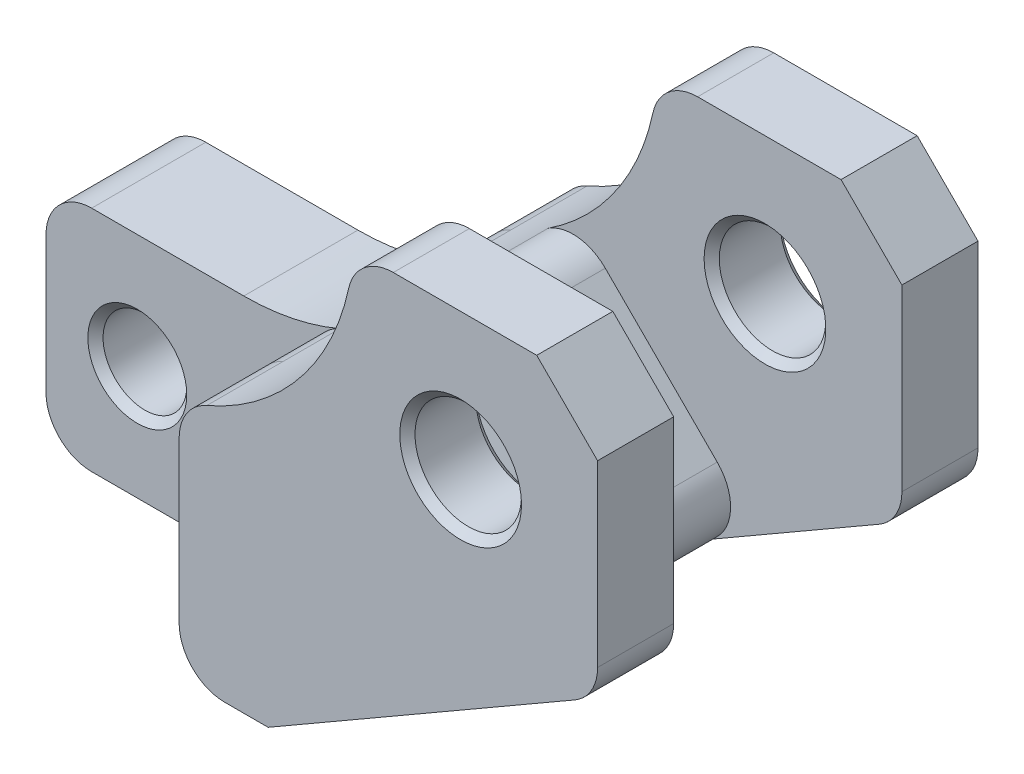
from build123d import *

# Parameters (mm, degrees)
BOSS_EXTRUDE1_DEPTH       = 10
FILLET1_R                 = 6
FILLET2_R                 = 6
FILLET3_R                 = 6
CUT_EXTRUDE1_REACH        = 92.604
SKETCH4_R                 = 7.000000000000001
CHAMFER1_SIZE             = 1
CHAMFER2_SIZE             = 1
BOSS_EXTRUDE2_DEPTH       = 7.5
FILLET4_R                 = 6
SKETCH5_R                 = 5.5
CUT_EXTRUDE2_DEPTH        = 15
CHAMFER3_SIZE             = 1
BOSS_EXTRUDE3_DEPTH       = 15
FILLET5_R                 = 6
FILLET1_OF_MIRROR16_R     = 6
FILLET2_OF_MIRROR16_R     = 6
FILLET3_OF_MIRROR16_R     = 6
CHAMFER1_OF_MIRROR16_SIZE = 1
CHAMFER2_OF_MIRROR16_SIZE = 1


with BuildPart() as part:
    # Sketch3 → Boss-Extrude1 (new body)
    with BuildSketch(Plane.XY.offset(15)):
        with BuildLine():
            Line((45.93743884534262, 45.00000000000001), (69.99999999999996, 45))
            Line((69.99999999999996, 45), (77.99999999999999, 37))
            Line((77.99999999999999, 37), (77.99999999999999, 9.999999999999998))
            Line((77.99999999999999, 9.999999999999998), (34.69872981077818, -15.000000000000004))
            Line((34.69872981077818, -15.000000000000004), (22.999999999999996, -15.000000000000005))
            Line((22.999999999999996, -15.000000000000005), (22.99999999999999, 16.291694934431824))
            ThreePointArc((22.99999999999999, 16.291694934431824), (39.00020339394204, 27.025270208047246), (45.93743884534262, 45.00000000000001))
        make_face()
    boss_extrude1 = extrude(amount=BOSS_EXTRUDE1_DEPTH)

    # Fillet1
    fillet1_edges = [part.edges().sort_by_distance(p)[0] for p in [
        (45.93743884534262, 45.00000000000001, 20),
    ]]
    fillet(fillet1_edges, radius=FILLET1_R)

    # Fillet2
    fillet2_edges = [part.edges().sort_by_distance(p)[0] for p in [
        (22.999999999999996, -15.000000000000005, 20),
    ]]
    fillet(fillet2_edges, radius=FILLET2_R)

    # Fillet3
    fillet3_edges = [part.edges().sort_by_distance(p)[0] for p in [
        (77.99999999999999, 9.999999999999998, 20),
        (22.999999999999993, 16.29169493443182, 20),
    ]]
    fillet(fillet3_edges, radius=FILLET3_R)

    # Sketch4 → Cut-Extrude1 (cut, up to next)
    with BuildSketch(Plane.XY.offset(25), mode=Mode.PRIVATE) as cut_extrude1_sk1:
        with Locations((59.999999999999986, 27)):
            Circle(SKETCH4_R)
    cut_extrude1_tool1 = extrude(cut_extrude1_sk1.sketch, amount=-CUT_EXTRUDE1_REACH, mode=Mode.PRIVATE) & part.part
    cut_extrude1 = cut_extrude1_tool1.solids().sort_by_distance((60, 27, 25))[0]
    add(cut_extrude1, mode=Mode.SUBTRACT)

    # Chamfer1
    chamfer1_edges = [part.edges().sort_by_distance(p)[0] for p in [
        (52.999999999999986, 27, 25),
    ]]
    chamfer(chamfer1_edges, length=CHAMFER1_SIZE)

    # Chamfer2
    chamfer2_edges = [part.edges().sort_by_distance(p)[0] for p in [
        (52.999999999999986, 27, 15),
    ]]
    chamfer(chamfer2_edges, length=CHAMFER2_SIZE)



with BuildPart() as body_2:
    # Sketch2 → Boss-Extrude2 (new, symmetric)
    with BuildSketch(Plane.XY):
        with BuildLine():
            Line((-12.000000000000009, 14.999999999999996), (13.999999999999993, 15.000000000000002))
            ThreePointArc((13.999999999999993, 15.000000000000002), (23.496761564827036, 16.441670206295278), (32.13782324188529, 20.636780013698527))
            Line((32.13782324188529, 20.636780013698527), (55.66799332242584, -2.893390066842031))
            Line((55.66799332242584, -2.893390066842031), (34.69872981077818, -15.000000000000004))
            Line((34.69872981077818, -15.000000000000004), (-12, -15.000000000000004))
            Line((-12, -15.000000000000004), (-12.000000000000009, 14.999999999999996))
        make_face()
    extrude(amount=BOSS_EXTRUDE2_DEPTH, both=True)

    # Fillet4
    fillet4_edges = [body_2.edges().sort_by_distance(p)[0] for p in [
        (-12.000000000000009, 14.999999999999996, 0),
        (32.13782324188529, 20.636780013698527, 0),
        (55.66799332242584, -2.893390066842031, 0),
        (-12, -15.000000000000004, 0),
    ]]
    fillet(fillet4_edges, radius=FILLET4_R)

    # Sketch5 → Cut-Extrude2 (cut)
    with BuildSketch(Plane.XY.offset(7.5)):
        Circle(SKETCH5_R)
    extrude(amount=-CUT_EXTRUDE2_DEPTH, mode=Mode.SUBTRACT)

    # Chamfer3
    chamfer3_edges = [body_2.edges().sort_by_distance(p)[0] for p in [
        (-5.5, 3.12e-15, 7.5),
        (-5.5, 3.12e-15, -7.5),
    ]]
    chamfer(chamfer3_edges, length=CHAMFER3_SIZE)


with BuildPart() as part_1:
    add(part.part)

    add(body_2.part)  # Boss-Extrude3 merges body 2
    # Sketch6 → Boss-Extrude3 (add, symmetric)
    with BuildSketch(Plane.XY):
        with BuildLine():
            Line((22.99999999999999, -15.000000000000004), (22.999999999999996, 16.291694934431828))
            ThreePointArc((22.999999999999996, 16.291694934431828), (29.533716734106008, 19.023158784012917), (35.30667046294364, 23.124787042132485))
            Line((35.30667046294364, 23.124787042132485), (59.25429521109807, -0.8228377060218555))
            Line((59.25429521109807, -0.8228377060218555), (34.69872981077818, -15.000000000000004))
            Line((34.69872981077818, -15.000000000000004), (22.99999999999999, -15.000000000000004))
        make_face()
    extrude(amount=BOSS_EXTRUDE3_DEPTH, both=True)

    # Fillet5
    fillet5_edges = [part_1.edges().sort_by_distance(p)[0] for p in [
        (22.99999999999999, -15.000000000000004, -11.25),
        (22.99999999999999, -15.000000000000004, 11.25),
        (22.999999999999996, 16.291694934431828, -11.25),
        (22.999999999999996, 16.291694934431828, 11.25),
        (59.25429521109807, -0.8228377060218555, 0),
        (35.30667046294364, 23.12478704213249, 0),
    ]]
    fillet(fillet5_edges, radius=FILLET5_R)


with BuildPart() as mirror16_1:
    # Mirror16: Boss-Extrude1 across plane
    add(boss_extrude1.mirror(Plane.XY))

    # Mirror16 2: Cut-Extrude1 across plane
    add(cut_extrude1.mirror(Plane.XY), mode=Mode.SUBTRACT)

    # Fillet1 of Mirror16
    fillet1_of_mirror16_edges = [mirror16_1.edges().sort_by_distance(p)[0] for p in [
        (45.93743884534262, 45.00000000000001, -20),
    ]]
    fillet(fillet1_of_mirror16_edges, radius=FILLET1_OF_MIRROR16_R)

    # Fillet2 of Mirror16
    fillet2_of_mirror16_edges = [mirror16_1.edges().sort_by_distance(p)[0] for p in [
        (22.999999999999996, -15.000000000000005, -20),
    ]]
    fillet(fillet2_of_mirror16_edges, radius=FILLET2_OF_MIRROR16_R)

    # Fillet3 of Mirror16
    fillet3_of_mirror16_edges = [mirror16_1.edges().sort_by_distance(p)[0] for p in [
        (77.99999999999999, 9.999999999999998, -20),
        (22.999999999999993, 16.29169493443182, -20),
    ]]
    fillet(fillet3_of_mirror16_edges, radius=FILLET3_OF_MIRROR16_R)

    # Chamfer1 of Mirror16
    chamfer1_of_mirror16_edges = [mirror16_1.edges().sort_by_distance(p)[0] for p in [
        (52.999999999999986, 27, -25),
    ]]
    chamfer(chamfer1_of_mirror16_edges, length=CHAMFER1_OF_MIRROR16_SIZE)

    # Chamfer2 of Mirror16
    chamfer2_of_mirror16_edges = [mirror16_1.edges().sort_by_distance(p)[0] for p in [
        (52.999999999999986, 27, -15),
    ]]
    chamfer(chamfer2_of_mirror16_edges, length=CHAMFER2_OF_MIRROR16_SIZE)


with BuildPart() as part_2:
    add(part_1.part)

    # Mirror16 united with what the copies tou: union Mirror16_1
    add(mirror16_1.part)


solid = part_2.part
